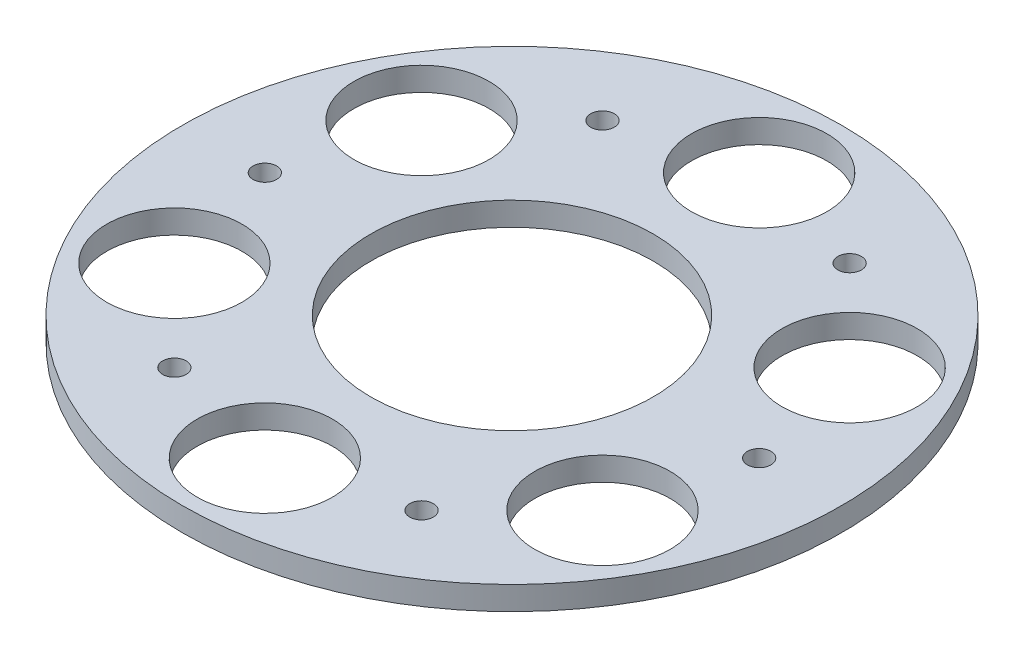
from build123d import *

# Parameters (mm, degrees)
SKETCH1_R           = 28
SKETCH1_R_2         = 5.75
SKETCH1_R_3         = 1
SKETCH1_R_4         = 12
BOSS_EXTRUDE1_DEPTH = 2


with BuildPart() as part:
    # Sketch1 → Boss-Extrude1 (new body)
    with BuildSketch(Plane(origin=(0, 0, 0), x_dir=(1, 0, 0), z_dir=(0, 1, 0))):
        with Locations(Location((0, 0, 0), (0, 0, 270))):
            Circle(SKETCH1_R)
        with Locations(Location((0, 21, 0), (0, 0, 270))):
            Circle(SKETCH1_R_2, mode=Mode.SUBTRACT)
        with Locations(Location((18.186533479, 10.5, 0), (0, 0, 270))):
            Circle(SKETCH1_R_2, mode=Mode.SUBTRACT)
        with Locations(Location((18.186533479, -10.5, 0), (0, 0, 270))):
            Circle(SKETCH1_R_2, mode=Mode.SUBTRACT)
        with Locations(Location((0, -21, 0), (0, 0, 270))):
            Circle(SKETCH1_R_2, mode=Mode.SUBTRACT)
        with Locations(Location((-18.186533479, -10.5, 0), (0, 0, 270))):
            Circle(SKETCH1_R_2, mode=Mode.SUBTRACT)
        with Locations(Location((-18.186533479, 10.5, 0), (0, 0, 270))):
            Circle(SKETCH1_R_2, mode=Mode.SUBTRACT)
        with Locations(Location((10.5, 18.186533479, 0), (0, 0, 270))):
            Circle(SKETCH1_R_3, mode=Mode.SUBTRACT)
        with Locations(Location((21, 0, 0), (0, 0, 270))):
            Circle(SKETCH1_R_3, mode=Mode.SUBTRACT)
        with Locations(Location((10.5, -18.186533479, 0), (0, 0, 270))):
            Circle(SKETCH1_R_3, mode=Mode.SUBTRACT)
        with Locations(Location((-10.5, -18.186533479, 0), (0, 0, 270))):
            Circle(SKETCH1_R_3, mode=Mode.SUBTRACT)
        with Locations(Location((-21, 0, 0), (0, 0, 270))):
            Circle(SKETCH1_R_3, mode=Mode.SUBTRACT)
        with Locations(Location((-10.5, 18.186533479, 0), (0, 0, 270))):
            Circle(SKETCH1_R_3, mode=Mode.SUBTRACT)
        with Locations(Location((0, 0, 0), (0, 0, 270))):
            Circle(SKETCH1_R_4, mode=Mode.SUBTRACT)
    extrude(amount=BOSS_EXTRUDE1_DEPTH)


solid = part.part
